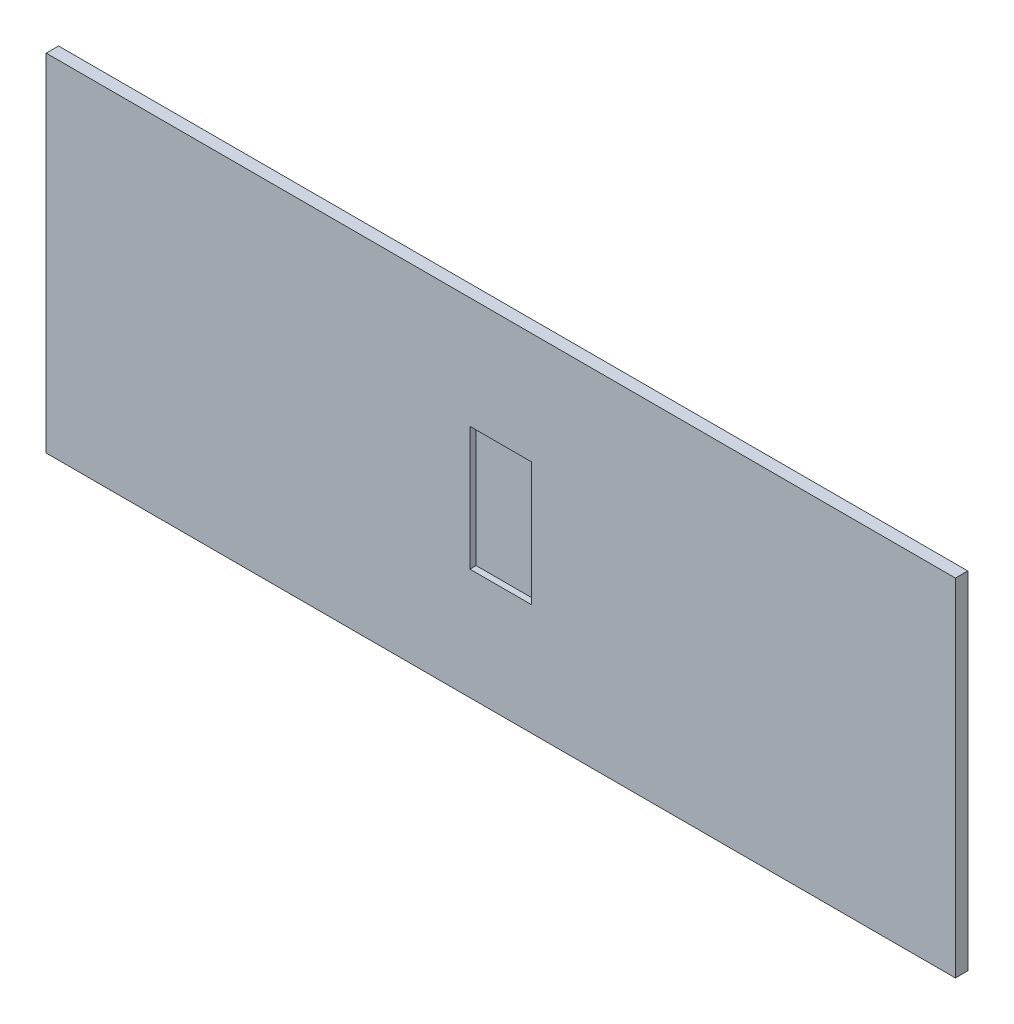
from build123d import *

# Parameters (mm, degrees)
ESQUISSE1_W             = 147
ESQUISSE1_H             = 56
BOSS_EXTRU_1_DEPTH      = 1
ESQUISSE2_W             = 10
ESQUISSE2_H             = 20
ENL_V_MAT_EXTRU_1_DEPTH = 1


with BuildPart() as part:
    # Esquisse1 → Boss.-Extru.1 (new, symmetric)
    with BuildSketch(Plane.XY):
        Rectangle(ESQUISSE1_W, ESQUISSE1_H)
    extrude(amount=BOSS_EXTRU_1_DEPTH, both=True)

    # Esquisse2 → Enlèv. mat.-Extru.1 (cut)
    with BuildSketch(Plane.XY.offset(1)):
        Rectangle(ESQUISSE2_W, ESQUISSE2_H)
    extrude(amount=-ENL_V_MAT_EXTRU_1_DEPTH, mode=Mode.SUBTRACT)


solid = part.part
